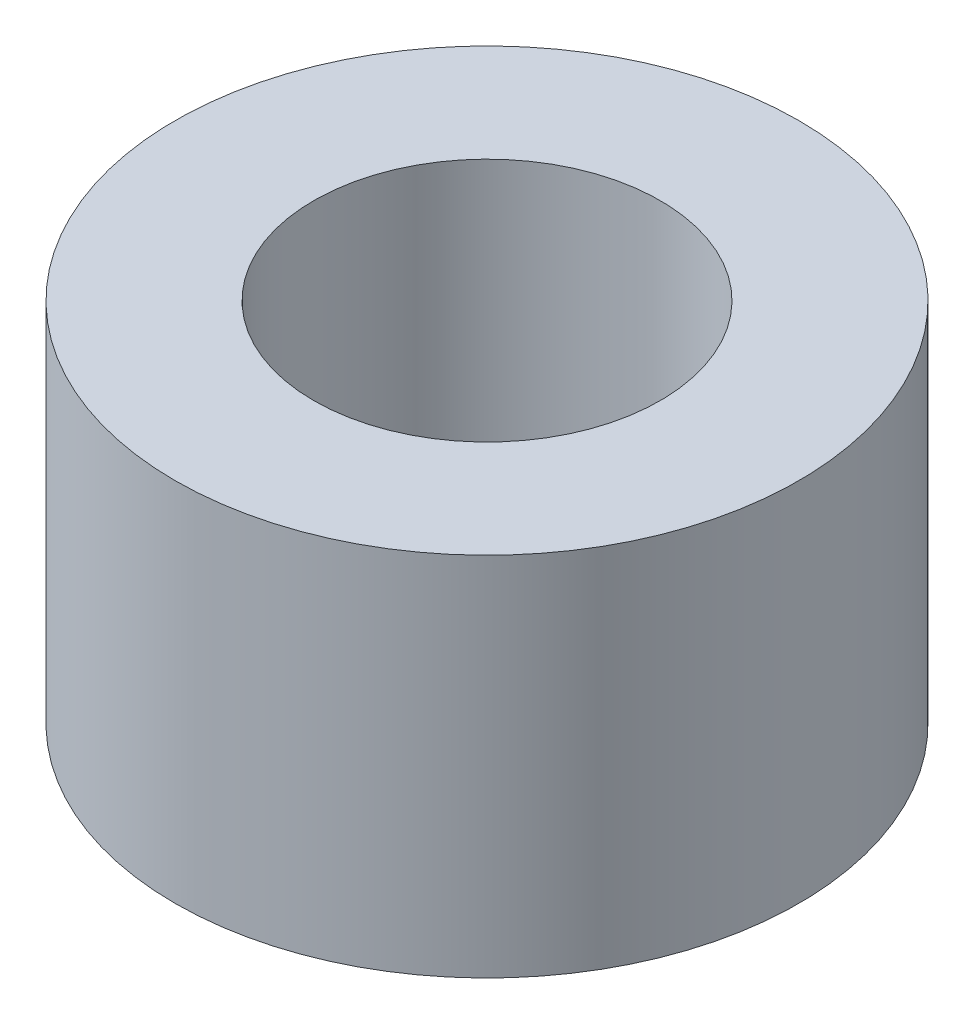
from build123d import *

# Parameters (mm, degrees)
SKETCH1_R           = 5.4
SKETCH1_R_2         = 3
BOSS_EXTRUDE1_DEPTH = 6.34


with BuildPart() as part:
    # Sketch1 → Boss-Extrude1 (new body)
    with BuildSketch(Plane(origin=(0, 0, 0), x_dir=(1, 0, 0), z_dir=(0, 1, 0))):
        with Locations(Location((0, 0, 0), (0, 0, 270))):
            Circle(SKETCH1_R)
        with Locations(Location((0, 0, 0), (0, 0, 270))):
            Circle(SKETCH1_R_2, mode=Mode.SUBTRACT)
    extrude(amount=BOSS_EXTRUDE1_DEPTH)


solid = part.part
